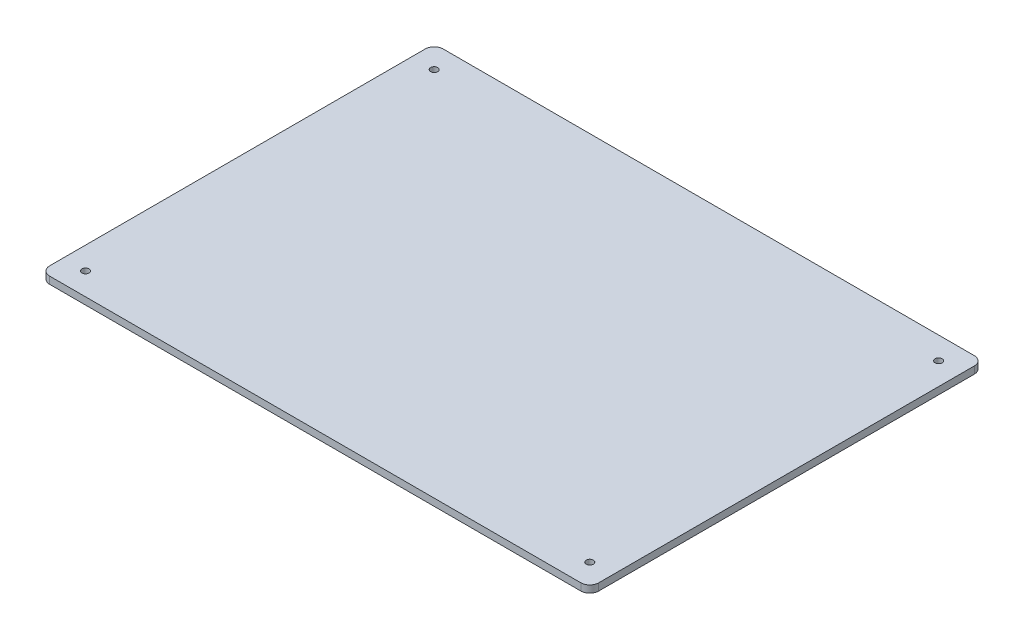
from build123d import *

# Parameters (mm, degrees)
BOSS_EXTRUDE1_DEPTH   = 4
F_4_0MM_DOWEL_HOLE1_D = 4


with BuildPart() as part:
    # Sketch2 → Boss-Extrude1 (new body)
    with BuildSketch(Plane(origin=(0, 0, 0), x_dir=(1, 0, 0), z_dir=(0, 1, 0))):
        with BuildLine():
            Line((148.5, -110), (-148.5, -110))
            ThreePointArc((-148.5, -110), (-152.035533906, -108.535533906), (-153.5, -105))
            Line((-153.5, -105), (-153.5, 105))
            ThreePointArc((-153.5, 105), (-152.035533906, 108.535533906), (-148.5, 110))
            Line((-148.5, 110), (148.5, 110))
            ThreePointArc((148.5, 110), (152.035533906, 108.535533906), (153.5, 105))
            Line((153.5, 105), (153.5, -105))
            ThreePointArc((153.5, -105), (152.035533906, -108.535533906), (148.5, -110))
        make_face()
    extrude(amount=BOSS_EXTRUDE1_DEPTH)

    # Ø4.0mm Dowel Hole1 (through all)
    with Locations(Plane(origin=(0, 4, 0), x_dir=(1, 0, 0), z_dir=(0, 1, 0))):
        with Locations((-141, 97.5), (-141, -97.5), (141, -97.5), (141, 97.5)):
            Hole(F_4_0MM_DOWEL_HOLE1_D / 2)


solid = part.part
